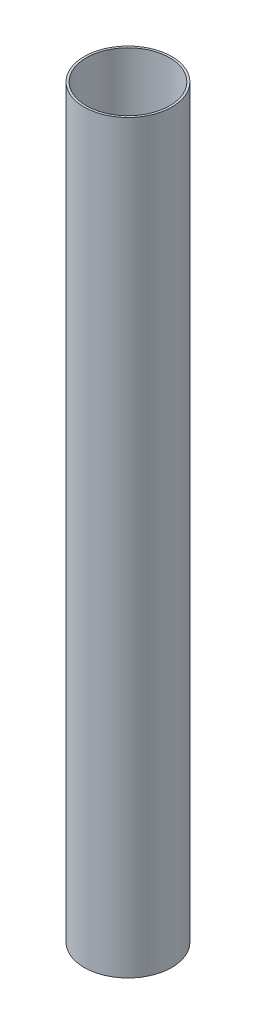
from build123d import *

# Parameters (mm, degrees)
SKETCH1_R           = 41.15
SKETCH1_R_2         = 39.15
BOSS_EXTRUDE1_DEPTH = 700


with BuildPart() as part:
    # Sketch1 → Boss-Extrude1 (new body)
    with BuildSketch(Plane(origin=(0, 0, 0), x_dir=(1, 0, 0), z_dir=(0, 1, 0))):
        with Locations(Location((0, 0, 0), (0, 0, 270))):
            Circle(SKETCH1_R)
        with Locations(Location((0, 0, 0), (0, 0, 270))):
            Circle(SKETCH1_R_2, mode=Mode.SUBTRACT)
    extrude(amount=BOSS_EXTRUDE1_DEPTH)


solid = part.part
